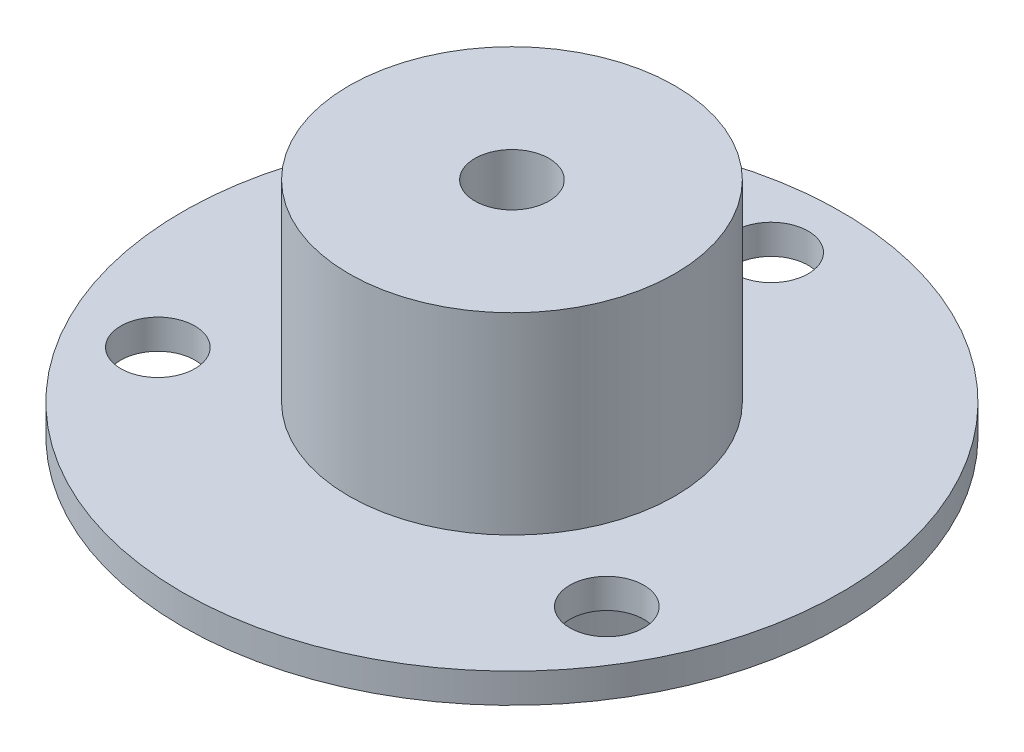
from build123d import *

# Parameters (mm, degrees)
SKETCH_1_R          = 22.25
SKETCH_1_R_2        = 2.5
EXTRUDE_1_DEPTH     = 2
SKETCH_3_R          = 11
SKETCH_3_R_2        = 2.5
EXTRUDE_3_DEPTH     = 13
EXTRUDE_START       = 6
SKETCH_4_R          = 11
EXTRUDE_4_DEPTH     = 6
SKETCH_6_R          = 2.5
CUT_EXTRUDE_2_DEPTH = 9


with BuildPart() as part:
    # 草图1 → 凸台-拉伸1 (new body)
    with BuildSketch(Plane(origin=(0, 0, 0), x_dir=(1, 0, 0), z_dir=(0, 1, 0))):
        with Locations(Location((0, 0, 0), (0, 0, 270))):
            Circle(SKETCH_1_R)
        with Locations(Location((0, 17.5, 0), (0, 0, 270))):
            Circle(SKETCH_1_R_2, mode=Mode.SUBTRACT)
        with Locations(Location((-15.155444566, -8.75, 0), (0, 0, 270))):
            Circle(SKETCH_1_R_2, mode=Mode.SUBTRACT)
        with Locations(Location((15.155444566, -8.75, 0), (0, 0, 270))):
            Circle(SKETCH_1_R_2, mode=Mode.SUBTRACT)
    extrude(amount=EXTRUDE_1_DEPTH)

    # 草图3 → 凸台-拉伸3 (add)
    with BuildSketch(Plane(origin=(0, 2, 0), x_dir=(1, 0, 0), z_dir=(0, 1, 0))):
        with Locations(Location((0, 0, 0), (0, 0, 90))):
            Circle(SKETCH_3_R)
        with Locations(Location((0, 0, 0), (0, 0, 90))):
            Circle(SKETCH_3_R_2, mode=Mode.SUBTRACT)
    extrude(amount=EXTRUDE_3_DEPTH)

    # 草图4 → 凸台-拉伸4 (add)
    with BuildSketch(Plane.XZ.offset(EXTRUDE_START)):
        with Locations(Location((0, 0, 0), (0, 0, 270))):
            Circle(SKETCH_4_R)
    extrude(amount=-EXTRUDE_4_DEPTH)

    # 草图6 → 切除-拉伸2 (cut)
    with BuildSketch(Plane.XZ.offset(6)):
        with Locations(Location((0, 0, 0), (0, 0, 270))):
            Circle(SKETCH_6_R)
    extrude(amount=-CUT_EXTRUDE_2_DEPTH, mode=Mode.SUBTRACT)


solid = part.part
